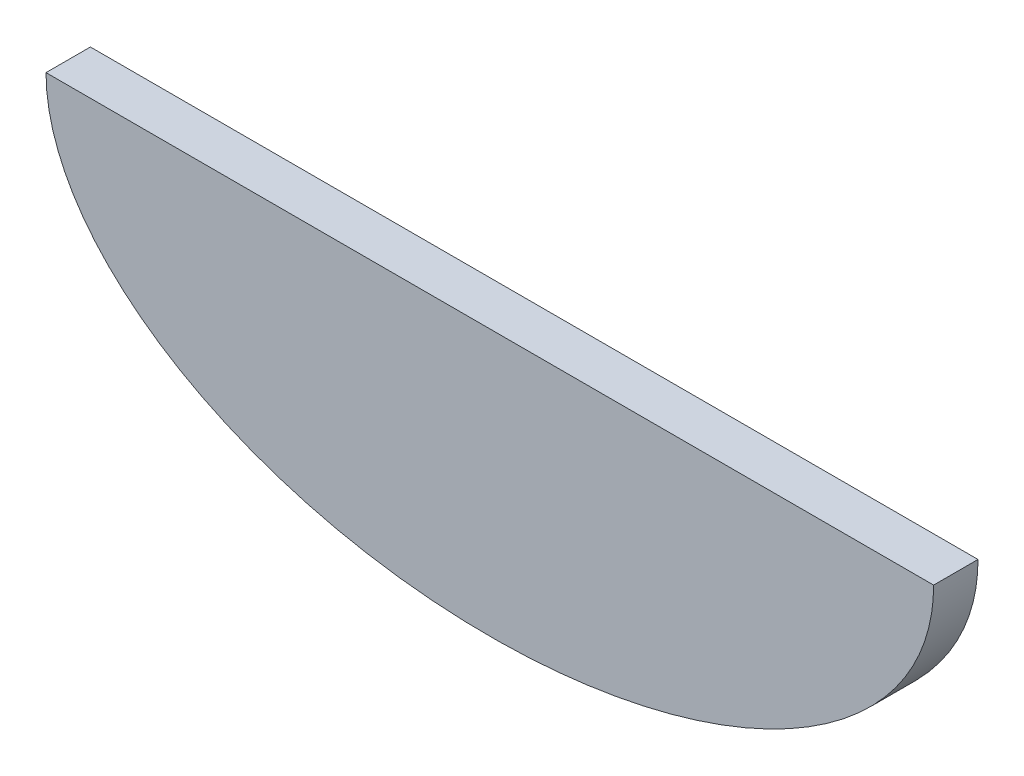
from build123d import *

# Parameters (mm, degrees)
SALIENTE_EXTRUIR1_DEPTH = 2


with BuildPart() as part:
    # Croquis1 → Saliente-Extruir1 (new body)
    with BuildSketch(Plane.XY):
        with BuildLine():
            Line((-20, 0), (20, 0))
            add(Edge.make_bspline(
                [(-20, 0), (-20, -12), (0, -12), (20, -12), (20, 0)],
                knots=[3.141592654, 3.141592654, 3.141592654, 4.71238898, 4.71238898, 6.283185307, 6.283185307, 6.283185307], degree=2, weights=[1, 0.707106781, 1, 0.707106781, 1]))
        make_face()
    extrude(amount=SALIENTE_EXTRUIR1_DEPTH)


solid = part.part
